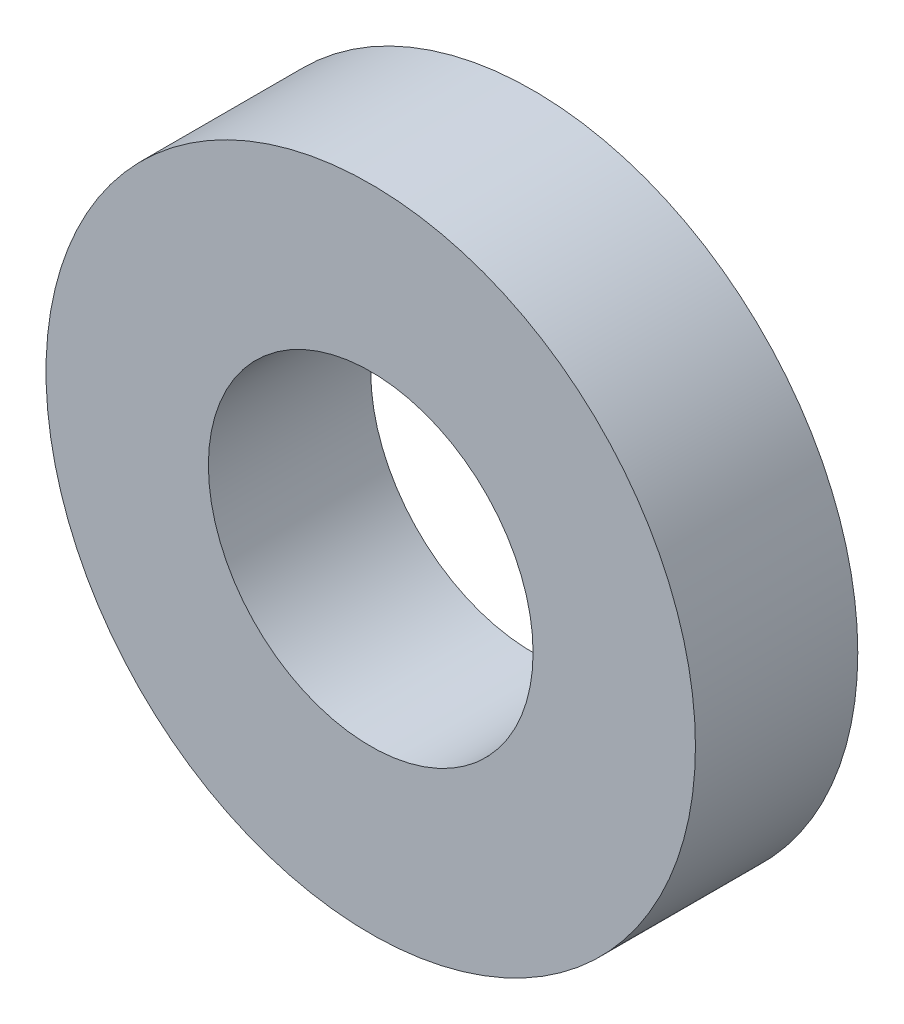
from build123d import *

# Parameters (mm, degrees)
SKETCH_1_R      = 4
SKETCH_1_R_2    = 2
EXTRUDE_1_DEPTH = 2


with BuildPart() as part:
    # 草图1 → 凸台-拉伸1 (new body)
    with BuildSketch(Plane.XY):
        Circle(SKETCH_1_R)
        Circle(SKETCH_1_R_2, mode=Mode.SUBTRACT)
    extrude(amount=EXTRUDE_1_DEPTH)


solid = part.part
